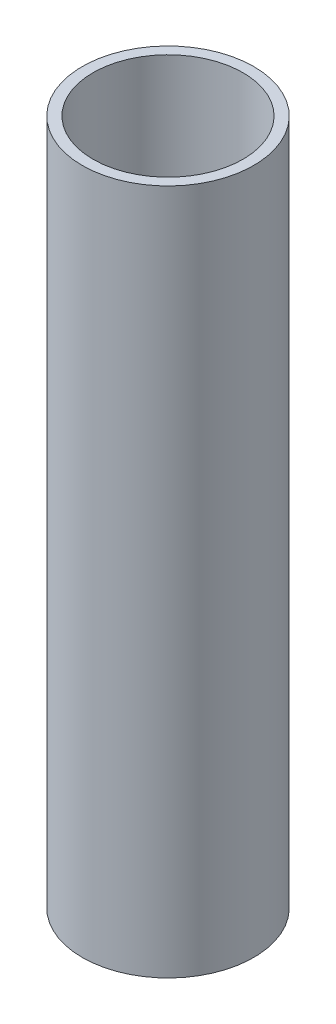
from build123d import *

# Parameters (mm, degrees)
SKETCH1_R           = 25.4
SKETCH1_R_2         = 22.225
BOSS_EXTRUDE1_DEPTH = 203.2


with BuildPart() as part:
    # Sketch1 → Boss-Extrude1 (new body)
    with BuildSketch(Plane(origin=(0, 0, 0), x_dir=(1, 0, 0), z_dir=(0, 1, 0))):
        with Locations(Location((0, 0, 0), (0, 0, 270))):
            Circle(SKETCH1_R)
        with Locations(Location((0, 0, 0), (0, 0, 270))):
            Circle(SKETCH1_R_2, mode=Mode.SUBTRACT)
    extrude(amount=BOSS_EXTRUDE1_DEPTH)


solid = part.part
